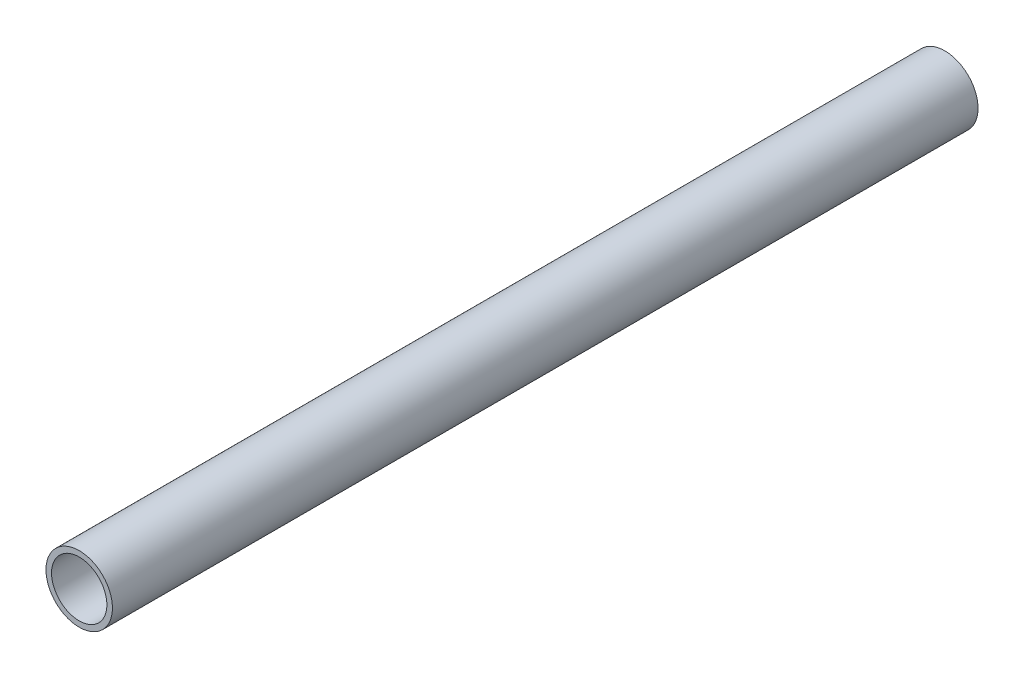
from build123d import *

# Parameters (mm, degrees)
SKETCH1_R           = 15
SKETCH1_R_2         = 12.5
BOSS_EXTRUDE1_DEPTH = 391


with BuildPart() as part:
    # Sketch1 → Boss-Extrude1 (new body)
    with BuildSketch(Plane.XY):
        with Locations(Location((0, 0, 0), (0, 0, 180))):
            Circle(SKETCH1_R)
        with Locations(Location((0, 0, 0), (0, 0, 180))):
            Circle(SKETCH1_R_2, mode=Mode.SUBTRACT)
    extrude(amount=BOSS_EXTRUDE1_DEPTH)


solid = part.part
